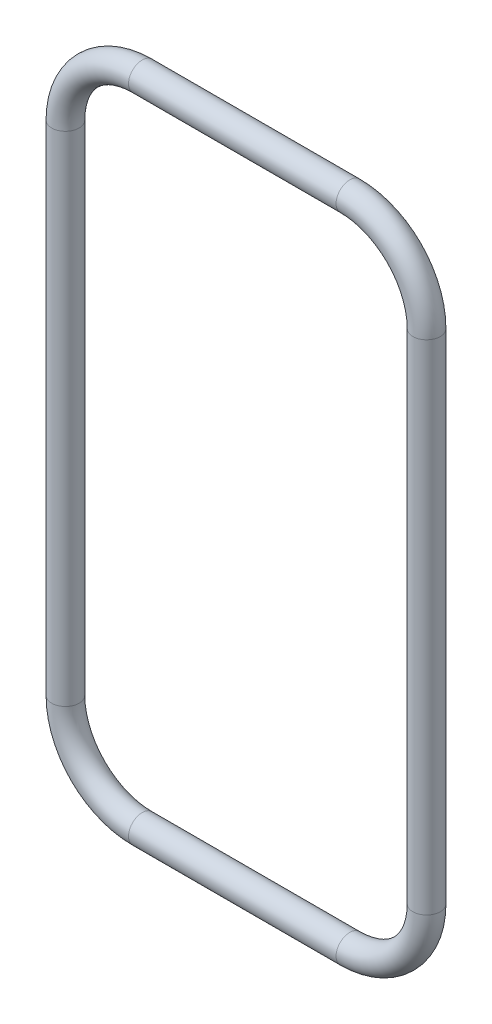
from build123d import *

# Parameters (mm, degrees)
SWEEP1_PROFILE_R = 1.65


with BuildPart() as part:
    # Sweep1: sweep along a path in Sketch1
    with BuildLine(Plane.XY) as sweep1_path:
        Line((69.249858, 19.99996), (69.249858, 79.99984))
        ThreePointArc((69.249858, 79.99984), (66.54060217, 86.54056217), (59.99988, 89.249818))
        Line((59.99988, 89.249818), (34.99993, 89.249818))
        ThreePointArc((34.99993, 89.249818), (28.45920783, 86.54056217), (25.749952, 79.99984))
        Line((25.749952, 79.99984), (25.749952, 19.99996))
        ThreePointArc((25.749952, 19.99996), (28.45920783, 13.45923783), (34.99993, 10.749982))
        Line((34.99993, 10.749982), (59.99988, 10.749982))
        ThreePointArc((59.99988, 10.749982), (66.54060217, 13.45923783), (69.249858, 19.99996))
    # Sweep1 profile (on start of the path) → Sweep1 (sweep)
    with BuildSketch(Plane(origin=(69.249858, 19.99996, 0), x_dir=(1, 0, 0), z_dir=(0, 1, 0))):
        Circle(SWEEP1_PROFILE_R)
    sweep(path=sweep1_path.line)


solid = part.part
